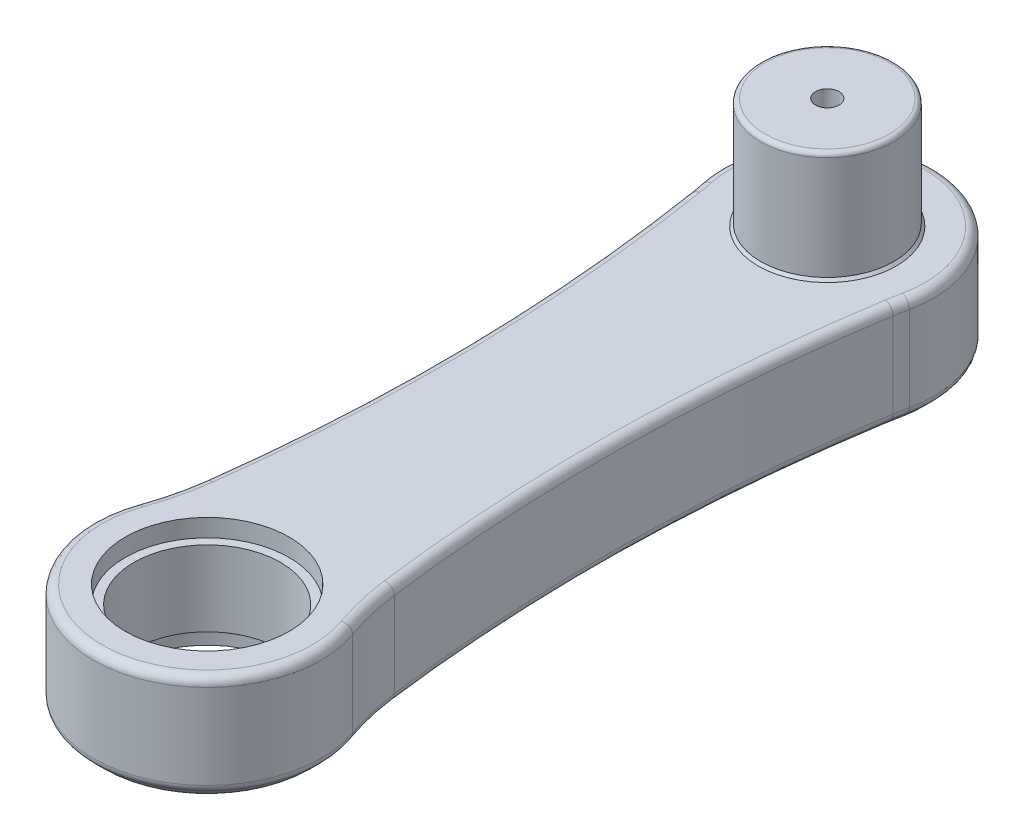
from build123d import *

# Parameters (mm, degrees)
BOSS_EXTRUDE1_DEPTH = 25
FILLET1_R           = 2
CHAMFER1_SIZE       = 3
FILLET2_R           = 2
SKETCH2_R           = 18.485
CUT_EXTRUDE1_DEPTH  = 4
CUT_EXTRUDE2_START  = -4
SKETCH3_R           = 18.485
CUT_EXTRUDE2_DEPTH  = 4
SKETCH4_R           = 16.55
CUT_EXTRUDE3_DEPTH  = 17
SKETCH5_R           = 15.01
BOSS_EXTRUDE2_DEPTH = 25
CHAMFER2_SIZE       = 0.58
SKETCH6_R           = 2.65
CUT_EXTRUDE4_DEPTH  = 50
SKETCH7_R           = 3
CUT_EXTRUDE5_DEPTH  = 8
FILLET3_R           = 1


with BuildPart() as part:
    # Sketch1 → Boss-Extrude1 (new body)
    with BuildSketch(Plane(origin=(0, 0, 0), x_dir=(1, 0, 0), z_dir=(0, 1, 0))):
        with BuildLine():
            ThreePointArc((-23.551733282, 64.9685132), (-23.241800216, 63.418036888), (-22.972830147, 61.85993214))
            ThreePointArc((-22.972830147, 61.85993214), (-18.177604442, 6.450509193), (-21.321060105, -49.077114809))
            ThreePointArc((-21.321060105, -49.077114809), (-22.464545398, -55.326974652), (-24.262510289, -61.420875612))
            ThreePointArc((-24.262510289, -61.420875612), (0, -95.73462222), (24.262510289, -61.420875612))
            ThreePointArc((24.262510289, -61.420875612), (22.464545398, -55.326974652), (21.321060105, -49.077114809))
            ThreePointArc((21.321060105, -49.077114809), (18.177604442, 6.450509193), (22.972830147, 61.85993214))
            ThreePointArc((22.972830147, 61.85993214), (23.241800216, 63.418036888), (23.551733282, 64.9685132))
            ThreePointArc((23.551733282, 64.9685132), (23.824132987, 66.477119443), (24, 68))
            ThreePointArc((24, 68), (0, 94.083189158), (-24, 68))
            ThreePointArc((-24, 68), (-23.824132987, 66.477119443), (-23.551733282, 64.9685132))
        make_face()
    extrude(amount=BOSS_EXTRUDE1_DEPTH)

    # Fillet1
    fillet1_edges = [part.edges().sort_by_distance(p)[0] for p in [
        (0, 25, 95.73462222),
        (22.464545398, 25, 55.326974652),
        (18.177604442, 25, -6.450509193),
        (23.241800216, 25, -63.418036888),
        (0, 25, -94.083189158),
        (-23.241800216, 25, -63.418036888),
        (-18.177604442, 25, -6.450509193),
        (-22.464545398, 25, 55.326974652),
    ]]
    fillet(fillet1_edges, radius=FILLET1_R)

    # Chamfer1
    chamfer1_edges = [part.edges().sort_by_distance(p)[0] for p in [
        (-18.177604442, 0, -6.450509193),
        (-23.241800216, 0, -63.418036888),
        (0, 0, -94.083189158),
        (23.241800216, 0, -63.418036888),
        (18.177604442, 0, -6.450509193),
        (22.464545398, 0, 55.326974652),
        (0, 0, 95.73462222),
        (-22.464545398, 0, 55.326974652),
    ]]
    chamfer(chamfer1_edges, length=CHAMFER1_SIZE)

    # Fillet2
    fillet2_edges = [part.edges().sort_by_distance(p)[0] for p in [
        (0, 0, 92.73462222),
        (19.546257825, 0, 56.0223865),
        (-19.546257825, 0, 56.0223865),
        (15.177936922, 0, -6.49517201),
        (-15.177936922, 0, -6.49517201),
        (20.292506075, 0, -63.967276425),
        (-20.292506075, 0, -63.967276425),
        (0, 0, -91.083189158),
        (0, 3, -94.083189158),
        (-23.241800216, 3, -63.418036888),
        (23.241800216, 3, -63.418036888),
        (-18.177604442, 3, -6.450509193),
        (18.177604442, 3, -6.450509193),
        (-22.464545398, 3, 55.326974652),
        (22.464545398, 3, 55.326974652),
        (0, 3, 95.73462222),
    ]]
    fillet(fillet2_edges, radius=FILLET2_R)

    # Sketch2 → Cut-Extrude1 (cut)
    with BuildSketch(Plane(origin=(0, 25, 0), x_dir=(1, 0, 0), z_dir=(0, 1, 0))):
        with Locations(Location((0, -70, 0), (0, 0, 270))):
            Circle(SKETCH2_R)
    extrude(amount=-CUT_EXTRUDE1_DEPTH, mode=Mode.SUBTRACT)

    # Sketch3 → Cut-Extrude2 (cut)
    with BuildSketch(Plane.XZ.offset(CUT_EXTRUDE2_START)):
        with Locations(Location((0, 70, 0), (0, 0, 90))):
            Circle(SKETCH3_R)
    extrude(amount=CUT_EXTRUDE2_DEPTH, mode=Mode.SUBTRACT)

    # Sketch4 → Cut-Extrude3 (cut)
    with BuildSketch(Plane.XZ.offset(-4)):
        with Locations(Location((0, 70, 0), (0, 0, 270))):
            Circle(SKETCH4_R)
    extrude(amount=-CUT_EXTRUDE3_DEPTH, mode=Mode.SUBTRACT)

    # Sketch5 → Boss-Extrude2 (add)
    with BuildSketch(Plane(origin=(0, 25, 0), x_dir=(1, 0, 0), z_dir=(0, 1, 0))):
        with Locations(Location((0, 70, 0), (0, 0, 270))):
            Circle(SKETCH5_R)
    extrude(amount=BOSS_EXTRUDE2_DEPTH)

    # Chamfer2
    chamfer2_edges = [part.edges().sort_by_distance(p)[0] for p in [
        (0, 25, -85.01),
    ]]
    chamfer(chamfer2_edges, length=CHAMFER2_SIZE)

    # Sketch6 → Cut-Extrude4 (cut)
    with BuildSketch(Plane(origin=(0, 50, 0), x_dir=(1, 0, 0), z_dir=(0, 1, 0))):
        with Locations(Location((0, 70, 0), (0, 0, 270))):
            Circle(SKETCH6_R)
    extrude(amount=-CUT_EXTRUDE4_DEPTH, mode=Mode.SUBTRACT)

    # Sketch7 → Cut-Extrude5 (cut)
    with BuildSketch(Plane.XZ):
        with Locations(Location((0, -70, 0), (0, 0, 270))):
            Circle(SKETCH7_R)
    extrude(amount=-CUT_EXTRUDE5_DEPTH, mode=Mode.SUBTRACT)

    # Fillet3
    fillet3_edges = [part.edges().sort_by_distance(p)[0] for p in [
        (0, 50, -85.01),
    ]]
    fillet(fillet3_edges, radius=FILLET3_R)


solid = part.part
